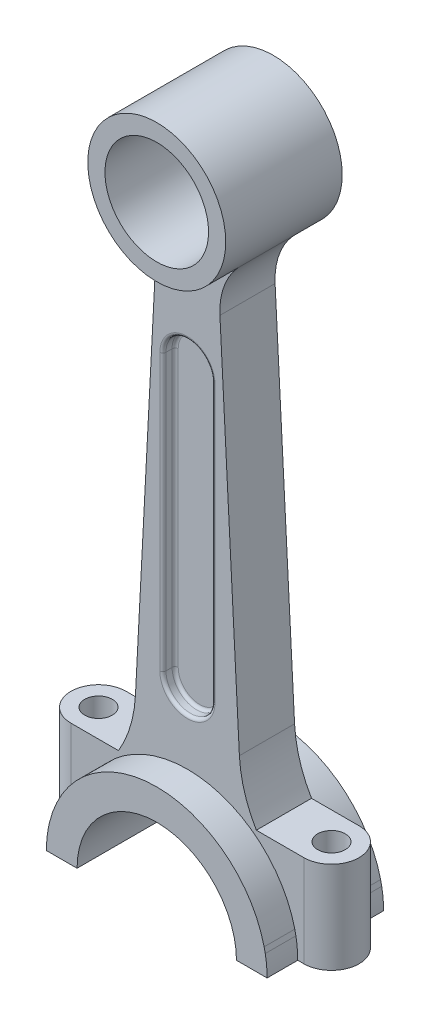
from build123d import *

# Parameters (mm, degrees)
BOSS_EXTRUDE4_DEPTH     = 19
SKETCH1_R               = 22.5
SKETCH1_R_2             = 16.9
BOSS_EXTRUDE4_2_DEPTH   = 19
BOSS_EXTRUDE5_DEPTH     = 9
CUT_EXTRUDE1_DEPTH      = 4
FILLET1_R               = 1
FILLET2_R               = 22.5
FILLET3_R               = 40
BOSS_EXTRUDE6_DEPTH     = 30
CUT_EXTRUDE2_DEPTH      = 209.505251732
CUT_EXTRUDE2_DEPTH_BACK = 209.505251732
SKETCH6_R               = 26
CUT_EXTRUDE3_DEPTH      = 201.224099449
CUT_EXTRUDE3_DEPTH_BACK = 201.224099449
SKETCH7_R               = 4.5


with BuildPart() as part:
    # Sketch1 → Boss-Extrude4 (new, symmetric)
    with BuildSketch(Plane.XY):
        with BuildLine():
            Line((-35.026029259, -192.882712321), (-35.389042583, -194.595784299))
            ThreePointArc((-35.389042583, -194.595784299), (-35.846935246, -197.883792302), (-36, -201.2))
            Line((-36, -201.2), (-26, -201.2))
            ThreePointArc((-26, -201.2), (0, -175.2), (26, -201.2))
            Line((26, -201.2), (36, -201.2))
            ThreePointArc((36, -201.2), (35.846935246, -197.883792302), (35.389042583, -194.595784299))
            Line((35.389042583, -194.595784299), (35.026029259, -192.882712321))
            ThreePointArc((35.026029259, -192.882712321), (0, -165.2), (-35.026029259, -192.882712321))
        make_face()
    extrude(amount=BOSS_EXTRUDE4_DEPTH, both=True)



with BuildPart() as body_2:
    # Sketch1 → Boss-Extrude4 2 (new, symmetric)
    with BuildSketch(Plane.XY):
        Circle(SKETCH1_R)
        Circle(SKETCH1_R_2, mode=Mode.SUBTRACT)
    extrude(amount=BOSS_EXTRUDE4_2_DEPTH, both=True)


with BuildPart() as part_1:
    add(part.part)

    add(body_2.part)  # Boss-Extrude5 merges body 2
    # Sketch1<7> → Boss-Extrude5 (add, symmetric)
    with BuildSketch(Plane.XY):
        with BuildLine():
            Line((-10, -20.155644371), (-17.849697213, -169.936789841))
            ThreePointArc((-17.849697213, -169.936789841), (0, -165.2), (17.849697213, -169.936789841))
            Line((17.849697213, -169.936789841), (10, -20.155644371))
            ThreePointArc((10, -20.155644371), (0, -22.5), (-10, -20.155644371))
        make_face()
    extrude(amount=BOSS_EXTRUDE5_DEPTH, both=True)

    # Sketch2 → Cut-Extrude1 (cut)
    with BuildSketch(Plane.XY.offset(9)):
        with BuildLine():
            Line((8, -51.932208026), (8, -141.932208026))
            ThreePointArc((8, -141.932208026), (0, -149.932208026), (-8, -141.932208026))
            Line((-8, -141.932208026), (-8, -51.932208026))
            ThreePointArc((-8, -51.932208026), (0, -43.932208026), (8, -51.932208026))
        make_face()
    cut_extrude1 = extrude(amount=-CUT_EXTRUDE1_DEPTH, mode=Mode.SUBTRACT)

    # Mirror1: Cut-Extrude1 across plane
    add(cut_extrude1.mirror(Plane.XY), mode=Mode.SUBTRACT)

    # Fillet1
    fillet1_edges = [part_1.edges().sort_by_distance(p)[0] for p in [
        (0, -43.932208026, 5),
        (8, -96.932208026, 5),
        (0, -149.932208026, 5),
        (-8, -96.932208026, 5),
        (0, -43.932208026, 9),
        (-8, -96.932208026, 9),
        (0, -149.932208026, 9),
        (8, -96.932208026, 9),
        (0, -43.932208026, -9),
        (-8, -96.932208026, -9),
        (0, -149.932208026, -9),
        (8, -96.932208026, -9),
        (0, -43.932208026, -5),
        (-8, -96.932208026, -5),
        (0, -149.932208026, -5),
        (8, -96.932208026, -5),
    ]]
    fillet(fillet1_edges, radius=FILLET1_R)

    # Fillet2
    fillet2_edges = [part_1.edges().sort_by_distance(p)[0] for p in [
        (10, -20.155644371, 0),
        (-10, -20.155644371, 0),
    ]]
    fillet(fillet2_edges, radius=FILLET2_R)

    # Fillet3
    fillet3_edges = [part_1.edges().sort_by_distance(p)[0] for p in [
        (-17.849697213, -169.936789841, 0),
        (17.849697213, -169.936789841, 0),
    ]]
    fillet(fillet3_edges, radius=FILLET3_R)

    # Sketch3 → Boss-Extrude6 (add)
    with BuildSketch(Plane(origin=(0, -171.2, 0), x_dir=(1, 0, 0), z_dir=(0, 1, 0))):
        with BuildLine():
            Line((-38, 9), (38, 9))
            ThreePointArc((38, 9), (47, 0), (38, -9))
            Line((38, -9), (-38, -9))
            ThreePointArc((-38, -9), (-47, 0), (-38, 9))
        make_face()
    extrude(amount=-BOSS_EXTRUDE6_DEPTH)

    # Sketch6 → Cut-Extrude2 (cut, two sides: drawn at the far end of the back side and taken through both)
    with BuildSketch(Plane.XY.offset(9).offset(-CUT_EXTRUDE2_DEPTH_BACK)):
        with Locations((0, -201.2)):
            Circle(SKETCH6_R)
    extrude(amount=CUT_EXTRUDE2_DEPTH + CUT_EXTRUDE2_DEPTH_BACK, mode=Mode.SUBTRACT)

    # Sketch7 → Cut-Extrude3 (cut, two sides: drawn at the far end of the back side and taken through both)
    with BuildSketch(Plane(origin=(0, -171.2, 0), x_dir=(1, 0, 0), z_dir=(0, 1, 0)).offset(-CUT_EXTRUDE3_DEPTH_BACK)):
        with Locations(Location((-38, 0, 0), (0, 0, 270))):
            Circle(SKETCH7_R)
        with Locations(Location((38, 0, 0), (0, 0, 270))):
            Circle(SKETCH7_R)
    extrude(amount=CUT_EXTRUDE3_DEPTH + CUT_EXTRUDE3_DEPTH_BACK, mode=Mode.SUBTRACT)


solid = part_1.part
